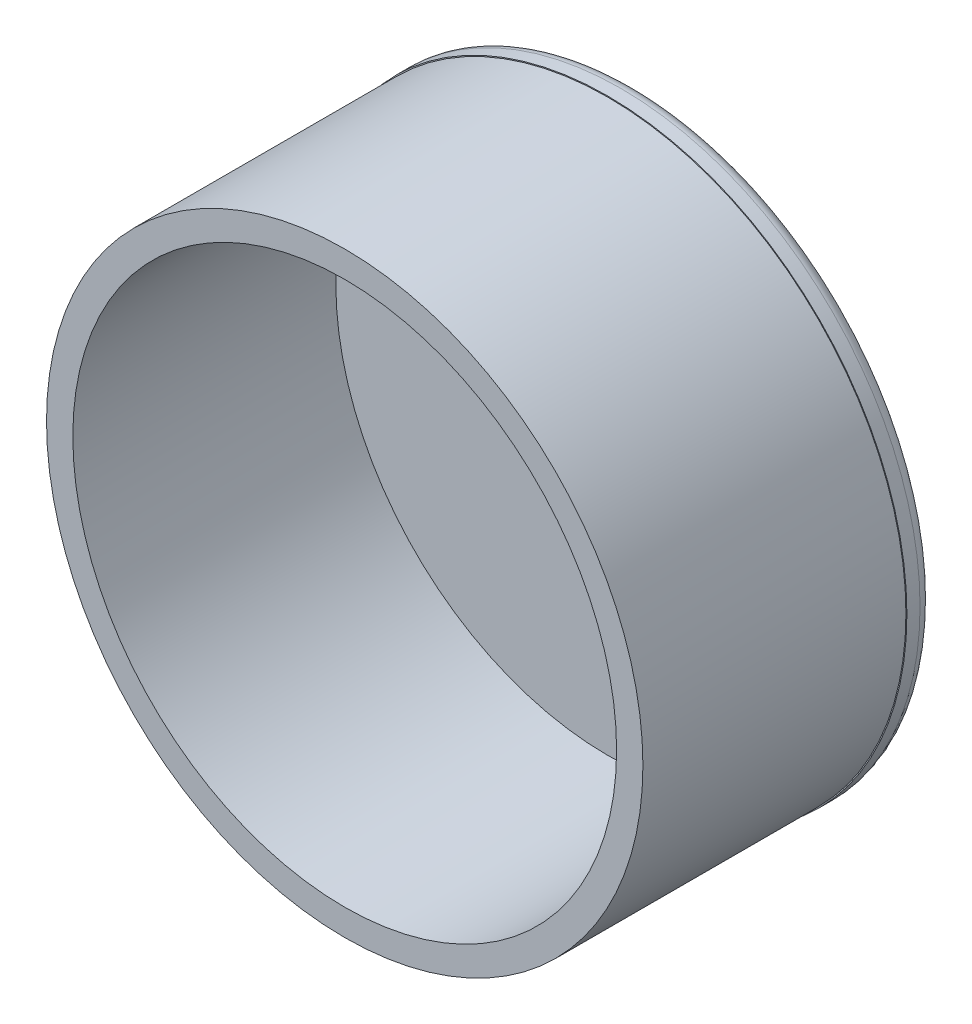
from build123d import *

# Parameters (mm, degrees)
SKETCH1_R           = 22.75
BOSS_EXTRUDE1_DEPTH = 2
SKETCH2_R           = 22.675423682
SKETCH2_R_2         = 20.675423682
BOSS_EXTRUDE2_DEPTH = 20
FILLET1_R           = 1


with BuildPart() as part:
    # Sketch1 → Boss-Extrude1 (new body)
    with BuildSketch(Plane.XY):
        Circle(SKETCH1_R)
    extrude(amount=BOSS_EXTRUDE1_DEPTH)

    # Sketch2 → Boss-Extrude2 (add)
    with BuildSketch(Plane.XY.offset(2)):
        Circle(SKETCH2_R)
        Circle(SKETCH2_R_2, mode=Mode.SUBTRACT)
    extrude(amount=BOSS_EXTRUDE2_DEPTH)

    # Fillet1
    fillet1_edges = [part.edges().sort_by_distance(p)[0] for p in [
        (-22.75, 0, 0),
    ]]
    fillet(fillet1_edges, radius=FILLET1_R)


solid = part.part
